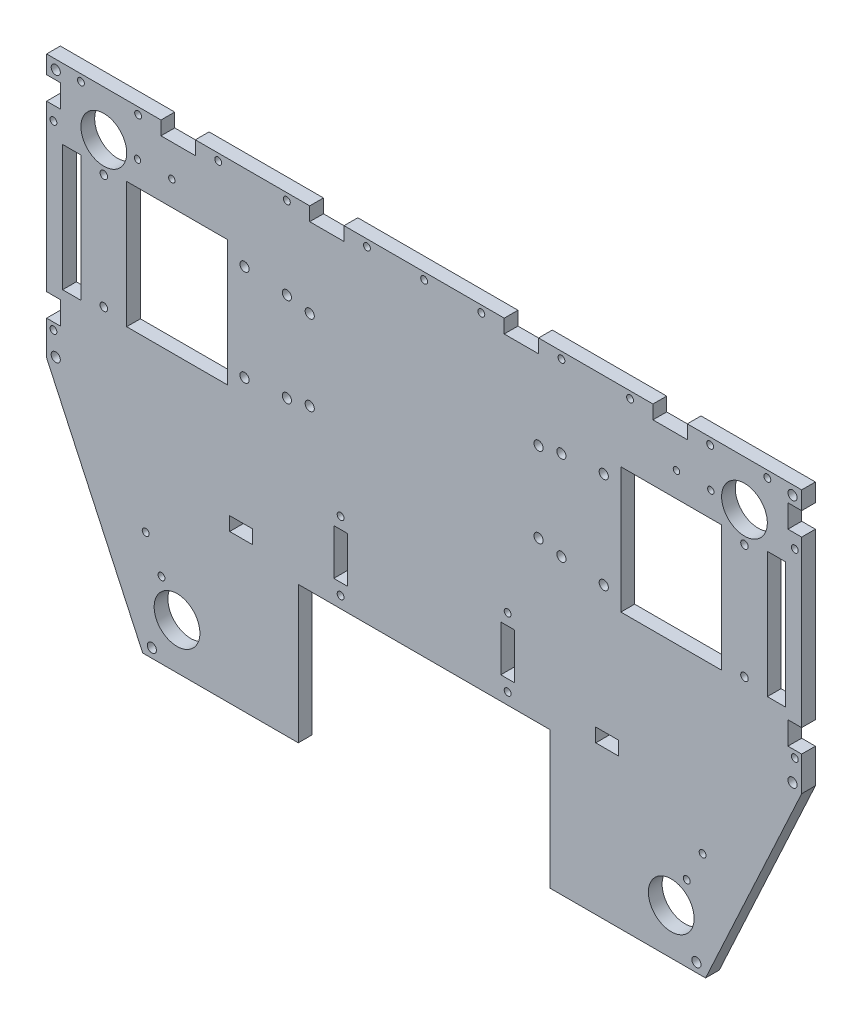
from build123d import *

# Parameters (mm, degrees)
BOSS_EXTRU_1_DEPTH      = 6
ESQUISSE2_R             = 10
ESQUISSE2_R_2           = 2
ESQUISSE2_R_3           = 1.4
ESQUISSE2_R_4           = 1.5
ESQUISSE2_W             = 8
ESQUISSE2_H             = 55
ESQUISSE2_W_2           = 44
ESQUISSE2_W_3           = 110
ESQUISSE2_H_2           = 60
ENL_V_MAT_EXTRU_1_DEPTH = 6
ESQUISSE3_W             = 6
ESQUISSE3_H             = 10
ESQUISSE3_W_2           = 15
ESQUISSE3_H_2           = 6
ENL_V_MAT_EXTRU_2_DEPTH = 6
ESQUISSE4_R             = 1.5
ENL_V_MAT_EXTRU_3_DEPTH = 6
ESQUISSE5_W             = 10
ESQUISSE5_H             = 6
ENL_V_MAT_EXTRU_4_DEPTH = 6
ESQUISSE6_R             = 1.65
ESQUISSE6_R_2           = 2
ENL_V_MAT_EXTRU_5_DEPTH = 6
ESQUISSE8_R             = 1.5
ESQUISSE8_W             = 6
ESQUISSE8_H             = 20
ENL_V_MAT_EXTRU_8_DEPTH = 6


with BuildPart() as part:
    # Esquisse1 → Boss.-Extru.1 (new body)
    with BuildSketch(Plane.XY):
        Polygon((-165, 96.73), (165, 96.73), (165, -18.27), (123, -109.022410436), (-123, -109.022410436), (-165, -18.27), align=None)
    extrude(amount=BOSS_EXTRU_1_DEPTH)

    # Esquisse2 → Enlèv. mat.-Extru.1 (cut)
    with BuildSketch(Plane.XY.offset(6)):
        with Locations((140, 76.73)):
            Circle(ESQUISSE2_R)
        with Locations((108, -89.022410436)):
            Circle(ESQUISSE2_R)
        with Locations(Location((-140, 76.73, 0), (0, 0, 180))):
            Circle(ESQUISSE2_R)
        with Locations(Location((-108, -89.022410436, 0), (0, 0, 180))):
            Circle(ESQUISSE2_R)
        with Locations((161, -16.022410436)):
            Circle(ESQUISSE2_R_2)
        with Locations((119, -105.022410436)):
            Circle(ESQUISSE2_R_2)
        with Locations((161, 92.73)):
            Circle(ESQUISSE2_R_2)
        with Locations(Location((-161, 92.73, 0), (0, 0, 180))):
            Circle(ESQUISSE2_R_2)
        with Locations(Location((-161, -16.022410436, 0), (0, 0, 180))):
            Circle(ESQUISSE2_R_2)
        with Locations(Location((-119, -105.022410436, 0), (0, 0, 180))):
            Circle(ESQUISSE2_R_2)
        with Locations((125.27, 76.73)):
            Circle(ESQUISSE2_R_3)
        with Locations((110.27, 76.73)):
            Circle(ESQUISSE2_R_3)
        with Locations((114.7893454, -75.950391119)):
            Circle(ESQUISSE2_R_4)
        with Locations((121.703139086, -62.638762485)):
            Circle(ESQUISSE2_R_4)
        with Locations(Location((-110.27, 76.73, 0), (0, 0, 180))):
            Circle(ESQUISSE2_R_3)
        with Locations(Location((-125.27, 76.73, 0), (0, 0, 180))):
            Circle(ESQUISSE2_R_3)
        with Locations(Location((-121.703139086, -62.638762485, 0), (0, 0, 180))):
            Circle(ESQUISSE2_R_4)
        with Locations(Location((-114.7893454, -75.950391119, 0), (0, 0, 180))):
            Circle(ESQUISSE2_R_4)
        with Locations((-154, 38.477589564)):
            Rectangle(ESQUISSE2_W, ESQUISSE2_H)
        with Locations((-108, 38.477589564)):
            Rectangle(ESQUISSE2_W_2, ESQUISSE2_H)
        with Locations((108, 38.477589564)):
            Rectangle(ESQUISSE2_W_2, ESQUISSE2_H)
        with Locations((154, 38.477589564)):
            Rectangle(ESQUISSE2_W, ESQUISSE2_H)
        with Locations((0, -79.022410436)):
            Rectangle(ESQUISSE2_W_3, ESQUISSE2_H_2)
    extrude(amount=-ENL_V_MAT_EXTRU_1_DEPTH, mode=Mode.SUBTRACT)

    # Esquisse3 → Enlèv. mat.-Extru.2 (cut)
    with BuildSketch(Plane(origin=(0, 0, 0), x_dir=(-1, 0, 0), z_dir=(0, 0, -1))):
        with Locations((162, 1.73)):
            Rectangle(ESQUISSE3_W, ESQUISSE3_H)
        with Locations((162, 83.852589564)):
            Rectangle(ESQUISSE3_W, ESQUISSE3_H)
        with Locations((-162, 83.852589564)):
            Rectangle(ESQUISSE3_W, ESQUISSE3_H)
        with Locations((-162, 1.73)):
            Rectangle(ESQUISSE3_W, ESQUISSE3_H)
        with Locations((107.5, 93.73)):
            Rectangle(ESQUISSE3_W_2, ESQUISSE3_H_2)
        with Locations((-42.5, 93.73)):
            Rectangle(ESQUISSE3_W_2, ESQUISSE3_H_2)
        with Locations((42.5, 93.73)):
            Rectangle(ESQUISSE3_W_2, ESQUISSE3_H_2)
        with Locations((-107.5, 93.73)):
            Rectangle(ESQUISSE3_W_2, ESQUISSE3_H_2)
    extrude(amount=-ENL_V_MAT_EXTRU_2_DEPTH, mode=Mode.SUBTRACT)

    # Esquisse4 → Enlèv. mat.-Extru.3 (cut)
    with BuildSketch(Plane(origin=(0, 0, 0), x_dir=(-1, 0, 0), z_dir=(0, 0, -1))):
        with Locations((162, -6.27)):
            Circle(ESQUISSE4_R)
        with Locations((162, 72.852589564)):
            Circle(ESQUISSE4_R)
        with Locations((0, 93.73)):
            Circle(ESQUISSE4_R)
        with Locations((150, 93.73)):
            Circle(ESQUISSE4_R)
        with Locations((125, 93.73)):
            Circle(ESQUISSE4_R)
        with Locations((90, 93.73)):
            Circle(ESQUISSE4_R)
        with Locations(Location((-25, 93.73, 0), (0, 0, 180))):
            Circle(ESQUISSE4_R)
        with Locations((60, 93.73)):
            Circle(ESQUISSE4_R)
        with Locations((25, 93.73)):
            Circle(ESQUISSE4_R)
        with Locations(Location((-60, 93.73, 0), (0, 0, 180))):
            Circle(ESQUISSE4_R)
        with Locations(Location((-90, 93.73, 0), (0, 0, 180))):
            Circle(ESQUISSE4_R)
        with Locations(Location((-125, 93.73, 0), (0, 0, 180))):
            Circle(ESQUISSE4_R)
        with Locations(Location((-150, 93.73, 0), (0, 0, 180))):
            Circle(ESQUISSE4_R)
        with Locations(Location((-162, 72.852589564, 0), (0, 0, 180))):
            Circle(ESQUISSE4_R)
        with Locations(Location((-162, -6.27, 0), (0, 0, 180))):
            Circle(ESQUISSE4_R)
    extrude(amount=-ENL_V_MAT_EXTRU_3_DEPTH, mode=Mode.SUBTRACT)

    # Esquisse5 → Enlèv. mat.-Extru.4 (cut)
    with BuildSketch(Plane(origin=(0, 0, 0), x_dir=(-1, 0, 0), z_dir=(0, 0, -1))):
        with Locations((80, -41.022410436)):
            Rectangle(ESQUISSE5_W, ESQUISSE5_H)
        with Locations((-80, -41.022410436)):
            Rectangle(ESQUISSE5_W, ESQUISSE5_H)
    extrude(amount=-ENL_V_MAT_EXTRU_4_DEPTH, mode=Mode.SUBTRACT)

    # Esquisse6 → Enlèv. mat.-Extru.5 (cut)
    with BuildSketch(Plane(origin=(0, 0, 0), x_dir=(-1, 0, 0), z_dir=(0, 0, -1))):
        with Locations((-140, 13.477589564)):
            Circle(ESQUISSE6_R)
        with Locations((-140, 63.477589564)):
            Circle(ESQUISSE6_R)
        with Locations(Location((140, 63.477589564, 0), (0, 0, 180))):
            Circle(ESQUISSE6_R)
        with Locations(Location((140, 13.477589564, 0), (0, 0, 180))):
            Circle(ESQUISSE6_R)
        with Locations((-78.5, 59.477589564)):
            Circle(ESQUISSE6_R_2)
        with Locations((-78.5, 17.477589564)):
            Circle(ESQUISSE6_R_2)
        with Locations((-60, 57.977589564)):
            Circle(ESQUISSE6_R_2)
        with Locations((-60, 18.977894939)):
            Circle(ESQUISSE6_R_2)
        with Locations((60, 18.977894939)):
            Circle(ESQUISSE6_R_2)
        with Locations((60, 57.977589564)):
            Circle(ESQUISSE6_R_2)
        with Locations((-50, 55.977589564)):
            Circle(ESQUISSE6_R_2)
        with Locations((50, 55.977589564)):
            Circle(ESQUISSE6_R_2)
        with Locations((50, 20.977589564)):
            Circle(ESQUISSE6_R_2)
        with Locations((-50, 20.977589564)):
            Circle(ESQUISSE6_R_2)
        with Locations(Location((78.5, 17.477589564, 0), (0, 0, 180))):
            Circle(ESQUISSE6_R_2)
        with Locations(Location((78.5, 59.477589564, 0), (0, 0, 180))):
            Circle(ESQUISSE6_R_2)
    extrude(amount=-ENL_V_MAT_EXTRU_5_DEPTH, mode=Mode.SUBTRACT)

    # Esquisse8 → Enlèv. mat.-Extru.8 (cut)
    with BuildSketch(Plane(origin=(0, 0, 0), x_dir=(-1, 0, 0), z_dir=(0, 0, -1))):
        with Locations((-36.5, -44.022410436)):
            Circle(ESQUISSE8_R)
        with Locations((-36.5, -14.022410436)):
            Circle(ESQUISSE8_R)
        with Locations(Location((36.5, -14.022410436, 0), (0, 0, 180))):
            Circle(ESQUISSE8_R)
        with Locations(Location((36.5, -44.022410436, 0), (0, 0, 180))):
            Circle(ESQUISSE8_R)
        with Locations((-36.5, -29.022410436)):
            Rectangle(ESQUISSE8_W, ESQUISSE8_H)
        with Locations((36.5, -29.022410436)):
            Rectangle(ESQUISSE8_W, ESQUISSE8_H)
    extrude(amount=-ENL_V_MAT_EXTRU_8_DEPTH, mode=Mode.SUBTRACT)


solid = part.part
